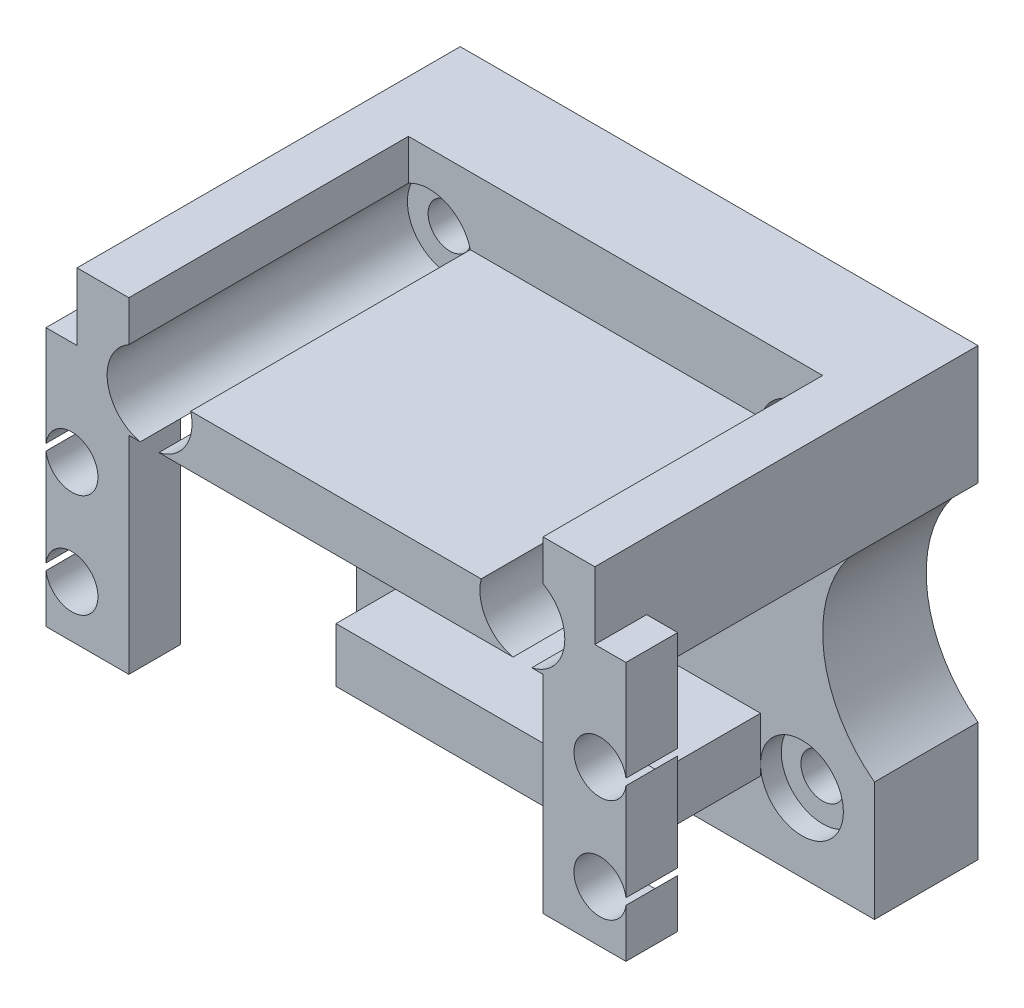
from build123d import *
from build123d.topology import SkipClean

# Parameters (mm, degrees)
SKETCH_1_R           = 2
EXTRUDE_1_DEPTH      = 5
EXTRUDE_5_DEPTH      = 18
SKETCH_6_W           = 40
SKETCH_6_H           = 5
EXTRUDE_6_DEPTH      = 25
SKETCH_7_W           = 40
SKETCH_7_H           = 5
EXTRUDE_7_DEPTH      = 27
SKETCH_9_R           = 10
CUT_EXTRUDE_4_DEPTH  = 50
SKETCH_10_W          = 8
SKETCH_10_H          = 5
EXTRUDE_9_DEPTH      = 20
CUT_EXTRUDE_8_DEPTH  = 20
CUT_EXTRUDE_9_DEPTH  = 20
SKETCH_16_W          = 40
SKETCH_16_H          = 4
EXTRUDE_10_DEPTH     = 5
SKETCH_17_W          = 40
SKETCH_17_H          = 4
EXTRUDE_12_DEPTH     = 12
SKETCH_18_R          = 1.5
CUT_EXTRUDE_10_DEPTH = 10
CUT_EXTRUDE_11_DEPTH = 10
SKETCH_22_W          = 39.912411086
SKETCH_22_H          = 12
CUT_EXTRUDE_12_DEPTH = 10
SKETCH_23_W          = 1.771441315
SKETCH_23_H          = 1.605869394
CUT_EXTRUDE_13_DEPTH = 10
SKETCH_24_W          = 40
SKETCH_24_H          = 4
EXTRUDE_13_DEPTH     = 7
SKETCH_26_R          = 1.5
CUT_EXTRUDE_14_DEPTH = 7
SKETCH_27_W          = 8
SKETCH_27_H          = 26.5
EXTRUDE_14_DEPTH     = 5
SKETCH_28_W          = 8
SKETCH_28_H          = 25
EXTRUDE_15_DEPTH     = 5
SKETCH_30_W          = 8
SKETCH_30_H          = 1.5
CUT_EXTRUDE_15_DEPTH = 5
SKETCH_31_R          = 2.52
CUT_EXTRUDE_16_DEPTH = 5
SKETCH_32_R          = 2.52
CUT_EXTRUDE_17_DEPTH = 5
CUT_EXTRUDE_18_DEPTH = 5
SKETCH_2_R           = 4
CUT_EXTRUDE_19_DEPTH = 3
SKETCH_35_W          = 4
SKETCH_35_H          = 12
CUT_EXTRUDE_20_DEPTH = 100
SKETCH_37_W          = 50
SKETCH_37_H          = 43
CUT_EXTRUDE_21_DEPTH = 100
SKETCH_38_W          = 50
SKETCH_38_H          = 43
SKETCH_38_R          = 10
EXTRUDE_20_DEPTH     = 5
SKETCH_39_W          = 50
SKETCH_39_H          = 43
SKETCH_39_W_2        = 40
SKETCH_39_H_2        = 30
EXTRUDE_21_DEPTH     = 5
CUT_EXTRUDE_START    = -100
SKETCH_41_R          = 2.1
SKETCH_41_R_2        = 10
CUT_EXTRUDE_23_DEPTH = 100
SKETCH_42_W          = 6
SKETCH_42_H          = 5
CUT_EXTRUDE_24_DEPTH = 13
SKETCH_43_R          = 4.1
CUT_EXTRUDE_27_DEPTH = 29
EXTRUDE_START        = 27
EXTRUDE_22_DEPTH     = 27
EXTRUDE_23_DEPTH     = 27
SKETCH_46_W          = 28
SKETCH_46_H          = 0.25
EXTRUDE_24_DEPTH     = 20
SKETCH_47_R          = 4
CUT_EXTRUDE_28_DEPTH = 2
CUT_EXTRUDE_29_DEPTH = 10
CUT_EXTRUDE_30_DEPTH = 10


with BuildPart() as part:
    # 草图1 → 凸台-拉伸1 (new body)
    with BuildSketch(Plane.XY):
        Polygon((0, 21.5), (25, 21.5), (25, -21.5), (-25, -21.5), (-25, 21.5), align=None)
        with Locations((-18, 14)):
            Circle(SKETCH_1_R, mode=Mode.SUBTRACT)
        with Locations((-18, -14)):
            Circle(SKETCH_1_R, mode=Mode.SUBTRACT)
        with Locations((18, -14)):
            Circle(SKETCH_1_R, mode=Mode.SUBTRACT)
        with Locations((18, 14)):
            Circle(SKETCH_1_R, mode=Mode.SUBTRACT)
    extrude(amount=EXTRUDE_1_DEPTH)

    # 草图5 → 凸台-拉伸5 (add)
    with BuildSketch(Plane.XY.offset(5)):
        Polygon((0, 26.5), (20, 26.5), (20, 21.5), (-20, 21.5), (-20, 26.5), align=None)
    extrude(amount=-EXTRUDE_5_DEPTH)

    # 草图6 → 凸台-拉伸6 (add)
    with BuildSketch(Plane(origin=(0, 26.5, 0), x_dir=(1, 0, 0), z_dir=(0, 1, 0))):
        with Locations((0, 10.5)):
            Rectangle(SKETCH_6_W, SKETCH_6_H)
    extrude(amount=EXTRUDE_6_DEPTH)

    # 草图7 → 凸台-拉伸7 (add)
    with BuildSketch(Plane.XY.offset(-8)):
        with Locations((0, 49)):
            Rectangle(SKETCH_7_W, SKETCH_7_H)
    extrude(amount=EXTRUDE_7_DEPTH)

    # 草图9 → 切除-拉伸4 (cut)
    with BuildSketch(Plane(origin=(0, 0, 0), x_dir=(-1, 0, 0), z_dir=(0, 0, -1))):
        Circle(SKETCH_9_R)
    extrude(amount=-CUT_EXTRUDE_4_DEPTH, mode=Mode.SUBTRACT)

    # 草图10 → 凸台-拉伸9 (add)
    with BuildSketch(Plane(origin=(0, 51.5, 0), x_dir=(1, 0, 0), z_dir=(0, 1, 0))):
        with Locations((-24, -16.5)):
            Rectangle(SKETCH_10_W, SKETCH_10_H)
        with Locations((24, -16.5)):
            Rectangle(SKETCH_10_W, SKETCH_10_H)
    extrude(amount=-EXTRUDE_9_DEPTH)

    # 草图12 → 切除-拉伸8 (cut)
    with BuildSketch(Plane(origin=(0, 0, 14), x_dir=(-1, 0, 0), z_dir=(0, 0, -1))):
        with BuildLine():
            Line((28, 46), (28, 47))
            Line((28, 47), (27.949489743, 47))
            ThreePointArc((27.949489743, 47), (23, 46.5), (27.949489743, 46))
            Line((27.949489743, 46), (28, 46))
        make_face()
        with BuildLine():
            Line((27.949489743, 36), (28, 36))
            Line((28, 36), (28, 37))
            Line((28, 37), (27.949489743, 37))
            ThreePointArc((27.949489743, 37), (23, 36.5), (27.949489743, 36))
        make_face()
    extrude(amount=-CUT_EXTRUDE_8_DEPTH, mode=Mode.SUBTRACT)

    # 草图15 → 切除-拉伸9 (cut)
    with BuildSketch(Plane(origin=(0, 0, 14), x_dir=(-1, 0, 0), z_dir=(0, 0, -1))):
        with BuildLine():
            ThreePointArc((-27.949489743, 46), (-23, 46.5), (-27.949489743, 47))
            Line((-27.949489743, 47), (-28, 47))
            Line((-28, 47), (-28, 46))
            Line((-28, 46), (-27.949489743, 46))
        make_face()
        with BuildLine():
            Line((-27.949489743, 37), (-28, 37))
            Line((-28, 37), (-28, 36))
            Line((-28, 36), (-27.949489743, 36))
            ThreePointArc((-27.949489743, 36), (-23, 36.5), (-27.949489743, 37))
        make_face()
    extrude(amount=-CUT_EXTRUDE_9_DEPTH, mode=Mode.SUBTRACT)

    # 草图16 → 凸台-拉伸10 (add)
    with BuildSketch(Plane(origin=(0, 51.5, 0), x_dir=(1, 0, 0), z_dir=(0, 1, 0))):
        with Locations((0, -21)):
            Rectangle(SKETCH_16_W, SKETCH_16_H)
    extrude(amount=-EXTRUDE_10_DEPTH)

    # 草图17 → 凸台-拉伸12 (add)
    with BuildSketch(Plane(origin=(0, 51.5, 0), x_dir=(1, 0, 0), z_dir=(0, 1, 0))):
        with Locations((0, -21)):
            Rectangle(SKETCH_17_W, SKETCH_17_H)
    extrude(amount=EXTRUDE_12_DEPTH)

    # 草图18 → 切除-拉伸10 (cut)
    with BuildSketch(Plane(origin=(0, 0, 19), x_dir=(-1, 0, 0), z_dir=(0, 0, -1))):
        with Locations((6, 59.5)):
            Circle(SKETCH_18_R)
        with Locations((13, 59.5)):
            Circle(SKETCH_18_R)
    extrude(amount=-CUT_EXTRUDE_10_DEPTH, mode=Mode.SUBTRACT)

    # 草图20 → 切除-拉伸11 (cut)
    with BuildSketch(Plane.XY.offset(23)):
        with BuildLine():
            ThreePointArc((8, 63.5), (16.485281374, 59.985281374), (20, 51.5))
            Line((20, 51.5), (20, 63.5))
            Line((20, 63.5), (8, 63.5))
        make_face()
    extrude(amount=-CUT_EXTRUDE_11_DEPTH, mode=Mode.SUBTRACT)

    # 草图22 → 切除-拉伸12 (cut)
    with BuildSketch(Plane.XY.offset(23)):
        with Locations((-0.043794457, 57.5)):
            Rectangle(SKETCH_22_W, SKETCH_22_H)
    extrude(amount=-CUT_EXTRUDE_12_DEPTH, mode=Mode.SUBTRACT)

    # 草图23 → 切除-拉伸13 (cut)
    with BuildSketch(Plane.XY.offset(23)):
        with Locations((20.269466875, 52.302934697)):
            Rectangle(SKETCH_23_W, SKETCH_23_H)
    extrude(amount=-CUT_EXTRUDE_13_DEPTH, mode=Mode.SUBTRACT)

    # 草图24 → 凸台-拉伸13 (add)
    with BuildSketch(Plane(origin=(0, 51.5, 0), x_dir=(1, 0, 0), z_dir=(0, 1, 0))):
        with Locations((0, -21)):
            Rectangle(SKETCH_24_W, SKETCH_24_H)
    extrude(amount=EXTRUDE_13_DEPTH)

    # 草图26 → 切除-拉伸14 (cut)
    with BuildSketch(Plane.XY.offset(23)):
        with Locations((-13, 54.5)):
            Circle(SKETCH_26_R)
        with Locations((-6, 54.5)):
            Circle(SKETCH_26_R)
    extrude(amount=-CUT_EXTRUDE_14_DEPTH, mode=Mode.SUBTRACT)

    # 草图27 → 凸台-拉伸14 (add)
    with BuildSketch(Plane.XY.offset(19)):
        with Locations((24, 38.25)):
            Rectangle(SKETCH_27_W, SKETCH_27_H)
    extrude(amount=-EXTRUDE_14_DEPTH)

    # 草图28 → 凸台-拉伸15 (add)
    with BuildSketch(Plane.XY.offset(19)):
        with Locations((-24, 39)):
            Rectangle(SKETCH_28_W, SKETCH_28_H)
    extrude(amount=-EXTRUDE_15_DEPTH)

    # 草图30 → 切除-拉伸15 (cut)
    with BuildSketch(Plane.XY.offset(19)):
        with Locations((24, 25.75)):
            Rectangle(SKETCH_30_W, SKETCH_30_H)
    extrude(amount=-CUT_EXTRUDE_15_DEPTH, mode=Mode.SUBTRACT)

    # 草图31 → 切除-拉伸16 (cut)
    with BuildSketch(Plane.XY.offset(19)):
        with Locations((25.5, 41.5)):
            Circle(SKETCH_31_R)
        with Locations((25.5, 31.5)):
            Circle(SKETCH_31_R)
    extrude(amount=-CUT_EXTRUDE_16_DEPTH, mode=Mode.SUBTRACT)

    # 草图32 → 切除-拉伸17 (cut)
    with BuildSketch(Plane.XY.offset(19)):
        with Locations((-25.5, 41.5)):
            Circle(SKETCH_32_R)
        with Locations((-25.5, 31.5)):
            Circle(SKETCH_32_R)
    extrude(amount=-CUT_EXTRUDE_17_DEPTH, mode=Mode.SUBTRACT)

    # 草图33 → 切除-拉伸18 (cut)
    with BuildSketch(Plane(origin=(0, 0, 19), x_dir=(-1, 0, 0), z_dir=(0, 0, -1))):
        with BuildLine():
            Line((-20, 58.5), (-20, 51.5))
            ThreePointArc((-20, 51.5), (-17.949747468, 56.449747468), (-13, 58.5))
            Line((-13, 58.5), (-20, 58.5))
        make_face()
        with BuildLine():
            Line((20, 58.5), (13, 58.5))
            ThreePointArc((13, 58.5), (17.949747468, 56.449747468), (20, 51.5))
            Line((20, 51.5), (20, 58.5))
        make_face()
    extrude(amount=-CUT_EXTRUDE_18_DEPTH, mode=Mode.SUBTRACT)

    # 草图2 → 切除-拉伸19 (cut)
    with BuildSketch(Plane.XY.offset(5)):
        with Locations((18, 14)):
            Circle(SKETCH_2_R)
        with Locations((-18, 14)):
            Circle(SKETCH_2_R)
        with Locations((-18, -14)):
            Circle(SKETCH_2_R)
        with Locations((18, -14)):
            Circle(SKETCH_2_R)
    extrude(amount=-CUT_EXTRUDE_19_DEPTH, mode=Mode.SUBTRACT)

    # 草图35 → 切除-拉伸20 (cut)
    with BuildSketch(Plane.ZY.offset(20)):
        with Locations((21, 52.5)):
            Rectangle(SKETCH_35_W, SKETCH_35_H)
    extrude(amount=-CUT_EXTRUDE_20_DEPTH, mode=Mode.SUBTRACT)

    # 草图37 → 切除-拉伸21 (cut)
    with BuildSketch(Plane.XY.offset(5)):
        Rectangle(SKETCH_37_W, SKETCH_37_H)
    extrude(amount=-CUT_EXTRUDE_21_DEPTH, mode=Mode.SUBTRACT)

    # 草图38 → 凸台-拉伸20 (add)
    with BuildSketch(Plane(origin=(0, 0, -13), x_dir=(-1, 0, 0), z_dir=(0, 0, -1))):
        with Locations((0, 36.5)):
            Rectangle(SKETCH_38_W, SKETCH_38_H)
        with Locations((0, 36.5)):
            Circle(SKETCH_38_R, mode=Mode.SUBTRACT)
    extrude(amount=EXTRUDE_20_DEPTH)

    # 草图39 → 凸台-拉伸21 (add)
    with BuildSketch(Plane.XY.offset(-13)):
        with Locations((0, 36.5)):
            Rectangle(SKETCH_39_W, SKETCH_39_H)
        with Locations((0, 36.5)):
            Rectangle(SKETCH_39_W_2, SKETCH_39_H_2, mode=Mode.SUBTRACT)
    extrude(amount=EXTRUDE_21_DEPTH)

    # 草图41 → 切除-拉伸23 (cut)
    with BuildSketch(Plane(origin=(0, 0, -18), x_dir=(-1, 0, 0), z_dir=(0, 0, -1)).offset(CUT_EXTRUDE_START)):
        with Locations((-18, 50.5)):
            Circle(SKETCH_41_R)
        with Locations((18, 50.5)):
            Circle(SKETCH_41_R)
        with Locations((18, 22.5)):
            Circle(SKETCH_41_R)
        with Locations((-18, 22.5)):
            Circle(SKETCH_41_R)
        with Locations(Location((0, 36.5, 0), (0, 0, 270))):
            Circle(SKETCH_41_R_2)
    extrude(amount=CUT_EXTRUDE_23_DEPTH, mode=Mode.SUBTRACT)

    # 草图42 → 切除-拉伸24 (cut)
    with BuildSketch(Plane.XY.offset(5)):
        with Locations((-17, 24)):
            Rectangle(SKETCH_42_W, SKETCH_42_H)
        with Locations((17, 24)):
            Rectangle(SKETCH_42_W, SKETCH_42_H)
    extrude(amount=-CUT_EXTRUDE_24_DEPTH, mode=Mode.SUBTRACT)

    # 草图43 → 切除-拉伸27 (cut)
    with BuildSketch(Plane.XY.offset(19)):
        with Locations((-18, 50.5)):
            Circle(SKETCH_43_R)
        with Locations((18, 50.5)):
            Circle(SKETCH_43_R)
    extrude(amount=-CUT_EXTRUDE_27_DEPTH, mode=Mode.SUBTRACT)

    # 草图44 → 凸台-拉伸22 (add)
    with SkipClean():  # the faces are left unmerged after this step: merging them gives an invalid solid
        with BuildSketch(Plane.XY.offset(-8).offset(EXTRUDE_START)):
            with BuildLine():
                Line((-25, 46.5), (-20, 46.5))
                Line((-20, 46.5), (-20, 46.920893966))
                ThreePointArc((-20, 46.920893966), (-22.1, 50.5), (-20, 54.079106034))
                Line((-20, 54.079106034), (-20, 58))
                Line((-20, 58), (-25, 58))
                Line((-25, 58), (-25, 46.5))
            make_face()
        extrude(amount=-EXTRUDE_22_DEPTH)

    # 草图45 → 凸台-拉伸23 (add)
    with SkipClean():  # the faces are left unmerged after this step: merging them gives an invalid solid
        with BuildSketch(Plane.XY.offset(-8).offset(EXTRUDE_START)):
            with BuildLine():
                Line((18.9, 46.5), (25, 46.5))
                Line((25, 46.5), (25, 58))
                Line((25, 58), (20, 58))
                Line((20, 58), (20, 54.079106034))
                ThreePointArc((20, 54.079106034), (22.057488307, 49.911112372), (18.9, 46.5))
            make_face()
        extrude(amount=-EXTRUDE_23_DEPTH)

    # 草图46 → 凸台-拉伸24 (add)
    with SkipClean():  # the faces are left unmerged after this step: merging them gives an invalid solid
        with BuildSketch(Plane.XY.offset(5)):
            with Locations((0, 26.625)):
                Rectangle(SKETCH_46_W, SKETCH_46_H)
        extrude(amount=-EXTRUDE_24_DEPTH)

    # 草图47 → 切除-拉伸28 (cut)
    with SkipClean():  # the faces are left unmerged after this step: merging them gives an invalid solid
        with BuildSketch(Plane.XY.offset(-8)):
            with Locations((-18, 22.5)):
                Circle(SKETCH_47_R)
            with Locations((18, 22.5)):
                Circle(SKETCH_47_R)
        extrude(amount=-CUT_EXTRUDE_28_DEPTH, mode=Mode.SUBTRACT)

    # 草图48 → 切除-拉伸29 (cut)
    with SkipClean():  # the faces are left unmerged after this step: merging them gives an invalid solid
        with BuildSketch(Plane.XY.offset(-8)):
            with BuildLine():
                Line((-25, 46.5), (-25, 26.5))
                ThreePointArc((-25, 26.5), (-19.999999498, 36.5), (-25, 46.5))
            make_face()
        extrude(amount=-CUT_EXTRUDE_29_DEPTH, mode=Mode.SUBTRACT)

    # 草图49 → 切除-拉伸30 (cut)
    with SkipClean():  # the faces are left unmerged after this step: merging them gives an invalid solid
        with BuildSketch(Plane.XY.offset(-8)):
            with BuildLine():
                Line((25, 46.5), (25, 26.5))
                ThreePointArc((25, 26.5), (20, 36.5), (25, 46.5))
            make_face()
        extrude(amount=-CUT_EXTRUDE_30_DEPTH, mode=Mode.SUBTRACT)


solid = part.part
